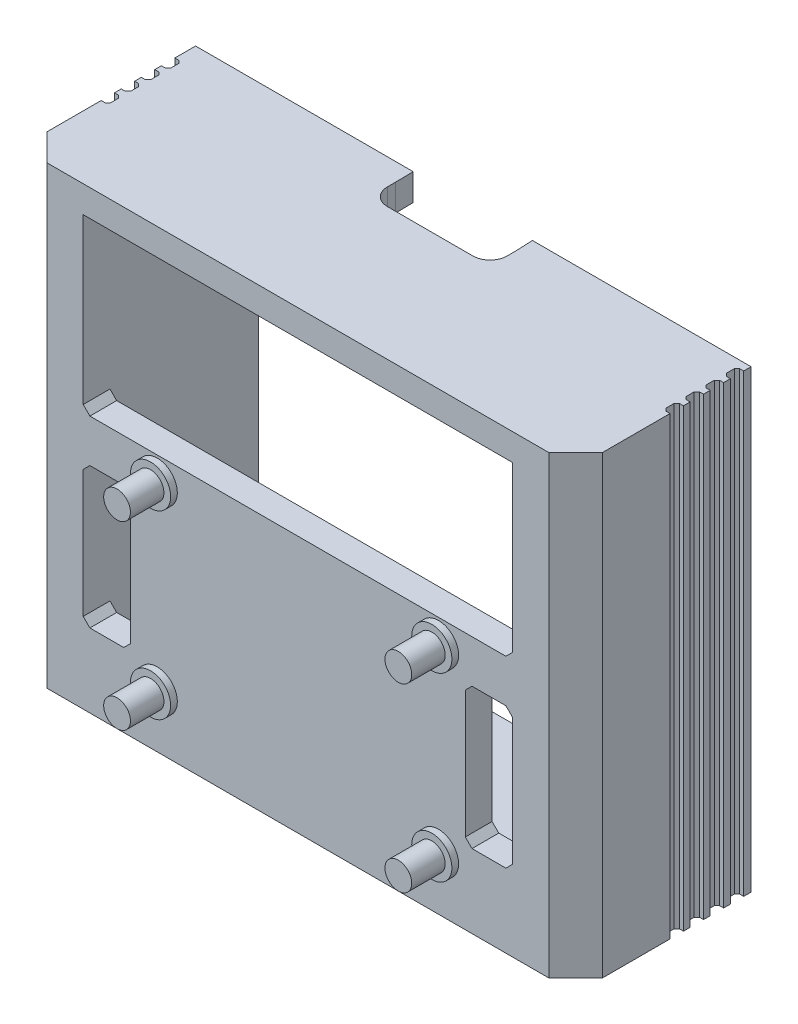
from build123d import *

# Parameters (mm, degrees)
SKETCH_1_W          = 4.708553468
SKETCH_1_H          = 29.97466091
EXTRUDE_1_DEPTH     = 4.1
EXTRUDE_1_2_DEPTH   = 4.1
SKETCH_2_W          = 4.708553468
SKETCH_2_H          = 29.97466091
EXTRUDE_2_DEPTH     = 9
SKETCH_3_W          = 6
SKETCH_3_H          = 29.97466091
EXTRUDE_3_DEPTH     = 32.057569214
SKETCH_6_R          = 1
EXTRUDE_4_DEPTH     = 3
SKETCH_7_R          = 1.5
EXTRUDE_5_DEPTH     = 0.5
CUT_EXTRUDE_1_REACH = 33.926
SKETCH_9_W          = 32.057569214
SKETCH_9_H          = 5.97466091
EXTRUDE_6_DEPTH     = 2
SKETCH_12_W         = 4.708553468
SKETCH_12_H         = 13.1
EXTRUDE_7_DEPTH     = 2
SKETCH_13_W         = 32.057569214
SKETCH_13_H         = 6
CUT_EXTRUDE_3_DEPTH = 6.8
CUT_EXTRUDE_4_REACH = 35.242
SKETCH_14_W         = 3.528784607
SKETCH_14_H         = 10.5
CHAMFER_1_SIZE      = 2
CHAMFER_2_SIZE      = 0.5
CUT_EXTRUDE_5_REACH = 44.936
SKETCH_15_W         = 0.5
SKETCH_15_H         = 1
CHAMFER_3_SIZE      = 0.2
CHAMFER_4_SIZE      = 0.2
SKETCH_16_W         = 32.057569214
SKETCH_16_H         = 2
EXTRUDE_8_DEPTH     = 13.1
CUT_EXTRUDE_7_REACH = 43.372
SKETCH_18_W         = 32.057569214
SKETCH_18_H         = 2
EXTRUDE_9_DEPTH     = 7.1
CUT_EXTRUDE_8_DEPTH = 4


with BuildPart() as part:
    # 草图1 → 凸台-拉伸1 (new body)
    with BuildSketch(Plane.XY):
        with Locations((-18.383061341, 5.449009398)):
            Rectangle(SKETCH_1_W, SKETCH_1_H)
    extrude(amount=EXTRUDE_1_DEPTH)



with BuildPart() as body_2:
    # 草图1 → Extrude 1 2 (new body)
    with BuildSketch(Plane.XY):
        with Locations((18.383061341, 5.449009398)):
            Rectangle(SKETCH_1_W, SKETCH_1_H)
    extrude(amount=EXTRUDE_1_2_DEPTH)


with BuildPart() as part_1:
    add(part.part)

    add(body_2.part)  # 凸台-拉伸2 merges body 2
    # 草图2 → 凸台-拉伸2 (add)
    with BuildSketch(Plane.XY.offset(4.1)):
        with Locations((-18.383061341, 5.449009398)):
            Rectangle(SKETCH_2_W, SKETCH_2_H)
        with Locations((18.383061341, 5.449009398)):
            Rectangle(SKETCH_2_W, SKETCH_2_H)
    extrude(amount=EXTRUDE_2_DEPTH)

    # 草图3 → 凸台-拉伸3 (add)
    with BuildSketch(Plane.ZY.offset(-16.028784607)):
        with Locations((10.1, 5.449009398)):
            Rectangle(SKETCH_3_W, SKETCH_3_H)
    extrude(amount=EXTRUDE_3_DEPTH)

    # 草图6 → 凸台-拉伸4 (add)
    with BuildSketch(Plane.XY.offset(13.1)):
        with Locations((-10.5, 5.961678943)):
            Circle(SKETCH_6_R)
        with Locations((10.5, -7.538321057)):
            Circle(SKETCH_6_R)
        with Locations((-10.5, -7.538321057)):
            Circle(SKETCH_6_R)
        with Locations((10.5, 5.961678943)):
            Circle(SKETCH_6_R)
    extrude(amount=EXTRUDE_4_DEPTH)

    # 草图7 → 凸台-拉伸5 (add)
    with BuildSketch(Plane.XY.offset(13.1)):
        with Locations((-10.5, 5.961678943)):
            Circle(SKETCH_7_R)
        with Locations((-10.5, -7.538321057)):
            Circle(SKETCH_7_R)
        with Locations(Location((10.5, -7.538321057, 0), (0, 0, 180))):
            Circle(SKETCH_7_R)
        with Locations(Location((10.5, 5.961678943, 0), (0, 0, 180))):
            Circle(SKETCH_7_R)
    extrude(amount=EXTRUDE_5_DEPTH)

    # 草图9 → 切除-拉伸1 (cut, up to next)
    with BuildSketch(Plane.XY.offset(13.1), mode=Mode.PRIVATE) as cut_extrude_1_sk1:
        with Locations((0, 17.449009398)):
            Rectangle(SKETCH_9_W, SKETCH_9_H)
    cut_extrude_1_tool1 = extrude(cut_extrude_1_sk1.sketch, amount=-CUT_EXTRUDE_1_REACH, mode=Mode.PRIVATE) & part_1.part
    add(cut_extrude_1_tool1.solids().sort_by_distance((0, 17.449009, 13.1))[0], mode=Mode.SUBTRACT)

    # 草图11 → 凸台-拉伸6 (add)
    with BuildSketch(Plane.XZ.offset(9.538321057)):
        Polygon((-20.737338075, 0), (-16.028784607, 0), (-16.028784607, 7.1), (16.028784607, 7.1), (16.028784607, 0), (20.737338075, 0), (20.737338075, 13.1), (-20.737338075, 13.1), align=None)
    extrude(amount=EXTRUDE_6_DEPTH)

    # 草图12 → 凸台-拉伸7 (add)
    with BuildSketch(Plane(origin=(0, 20.436339853, 0), x_dir=(1, 0, 0), z_dir=(0, 1, 0))):
        with Locations((18.383061341, -6.55)):
            Rectangle(SKETCH_12_W, SKETCH_12_H)
        with Locations((-18.383061341, -6.55)):
            Rectangle(SKETCH_12_W, SKETCH_12_H)
    extrude(amount=EXTRUDE_7_DEPTH)

    # 草图13 → 切除-拉伸3 (cut)
    with BuildSketch(Plane(origin=(0, 14.461678943, 0), x_dir=(1, 0, 0), z_dir=(0, 1, 0))):
        with Locations((0, -10.1)):
            Rectangle(SKETCH_13_W, SKETCH_13_H)
    extrude(amount=-CUT_EXTRUDE_3_DEPTH, mode=Mode.SUBTRACT)

    # 草图14 → 切除-拉伸4 (cut, up to next)
    with BuildSketch(Plane.XY.offset(13.1), mode=Mode.PRIVATE) as cut_extrude_4_sk1:
        with Locations((-14.264392304, -0.788321057)):
            Rectangle(SKETCH_14_W, SKETCH_14_H)
    cut_extrude_4_tool1 = extrude(cut_extrude_4_sk1.sketch, amount=-CUT_EXTRUDE_4_REACH, mode=Mode.PRIVATE) & part_1.part
    # 草图14 → 切除-拉伸4 (cut, up to next)
    with BuildSketch(Plane.XY.offset(13.1), mode=Mode.PRIVATE) as cut_extrude_4_sk2:
        with Locations((14.264392304, -0.788321057)):
            Rectangle(SKETCH_14_W, SKETCH_14_H)
    cut_extrude_4_tool2 = extrude(cut_extrude_4_sk2.sketch, amount=-CUT_EXTRUDE_4_REACH, mode=Mode.PRIVATE) & part_1.part
    add(cut_extrude_4_tool1.solids().sort_by_distance((-14.264392, -0.788321, 13.1))[0], mode=Mode.SUBTRACT)
    add(cut_extrude_4_tool2.solids().sort_by_distance((14.264392, -0.788321, 13.1))[0], mode=Mode.SUBTRACT)

    # 倒角1
    chamfer_1_edges = [part_1.edges().sort_by_distance(p)[0] for p in [
        (-20.737338075, 5.449009398, 13.1),
        (20.737338075, 5.449009398, 13.1),
    ]]
    chamfer(chamfer_1_edges, length=CHAMFER_1_SIZE)

    # 倒角2
    chamfer_2_edges = [part_1.edges().sort_by_distance(p)[0] for p in [
        (16.028784607, 7.661678943, 10.1),
        (-16.028784607, 7.661678943, 10.1),
        (-16.028784607, -6.038321057, 10.1),
        (-12.5, 4.461678943, 10.1),
        (-12.5, -6.038321057, 10.1),
        (-16.028784607, 4.461678943, 10.1),
        (16.028784607, 4.461678943, 10.1),
        (12.5, 4.461678943, 10.1),
        (16.028784607, -6.038321057, 10.1),
        (12.5, -6.038321057, 10.1),
    ]]
    chamfer(chamfer_2_edges, length=CHAMFER_2_SIZE)

    # 草图15 → 切除-拉伸5 (cut, up to next)
    with BuildSketch(Plane.XZ.offset(11.538321057), mode=Mode.PRIVATE) as cut_extrude_5_sk1:
        with Locations((-20.487338075, 5.05)):
            Rectangle(SKETCH_15_W, SKETCH_15_H)
    cut_extrude_5_tool1 = extrude(cut_extrude_5_sk1.sketch, amount=-CUT_EXTRUDE_5_REACH, mode=Mode.PRIVATE) & part_1.part
    # 草图15 → 切除-拉伸5 (cut, up to next)
    with BuildSketch(Plane.XZ.offset(11.538321057), mode=Mode.PRIVATE) as cut_extrude_5_sk2:
        with Locations((-20.487338075, 3.55)):
            Rectangle(SKETCH_15_W, SKETCH_15_H)
    cut_extrude_5_tool2 = extrude(cut_extrude_5_sk2.sketch, amount=-CUT_EXTRUDE_5_REACH, mode=Mode.PRIVATE) & part_1.part
    # 草图15 → 切除-拉伸5 (cut, up to next)
    with BuildSketch(Plane.XZ.offset(11.538321057), mode=Mode.PRIVATE) as cut_extrude_5_sk3:
        with Locations((-20.487338075, 2.05)):
            Rectangle(SKETCH_15_W, SKETCH_15_H)
    cut_extrude_5_tool3 = extrude(cut_extrude_5_sk3.sketch, amount=-CUT_EXTRUDE_5_REACH, mode=Mode.PRIVATE) & part_1.part
    # 草图15 → 切除-拉伸5 (cut, up to next)
    with BuildSketch(Plane.XZ.offset(11.538321057), mode=Mode.PRIVATE) as cut_extrude_5_sk4:
        with Locations((-20.487338075, 6.55)):
            Rectangle(SKETCH_15_W, SKETCH_15_H)
    cut_extrude_5_tool4 = extrude(cut_extrude_5_sk4.sketch, amount=-CUT_EXTRUDE_5_REACH, mode=Mode.PRIVATE) & part_1.part
    # 草图15 → 切除-拉伸5 (cut, up to next)
    with BuildSketch(Plane.XZ.offset(11.538321057), mode=Mode.PRIVATE) as cut_extrude_5_sk5:
        with Locations((20.487338075, 5.55)):
            Rectangle(SKETCH_15_W, SKETCH_15_H)
    cut_extrude_5_tool5 = extrude(cut_extrude_5_sk5.sketch, amount=-CUT_EXTRUDE_5_REACH, mode=Mode.PRIVATE) & part_1.part
    # 草图15 → 切除-拉伸5 (cut, up to next)
    with BuildSketch(Plane.XZ.offset(11.538321057), mode=Mode.PRIVATE) as cut_extrude_5_sk6:
        with Locations((20.487338075, 1.05)):
            Rectangle(SKETCH_15_W, SKETCH_15_H)
    cut_extrude_5_tool6 = extrude(cut_extrude_5_sk6.sketch, amount=-CUT_EXTRUDE_5_REACH, mode=Mode.PRIVATE) & part_1.part
    # 草图15 → 切除-拉伸5 (cut, up to next)
    with BuildSketch(Plane.XZ.offset(11.538321057), mode=Mode.PRIVATE) as cut_extrude_5_sk7:
        with Locations((20.487338075, 2.55)):
            Rectangle(SKETCH_15_W, SKETCH_15_H)
    cut_extrude_5_tool7 = extrude(cut_extrude_5_sk7.sketch, amount=-CUT_EXTRUDE_5_REACH, mode=Mode.PRIVATE) & part_1.part
    # 草图15 → 切除-拉伸5 (cut, up to next)
    with BuildSketch(Plane.XZ.offset(11.538321057), mode=Mode.PRIVATE) as cut_extrude_5_sk8:
        with Locations((20.487338075, 4.05)):
            Rectangle(SKETCH_15_W, SKETCH_15_H)
    cut_extrude_5_tool8 = extrude(cut_extrude_5_sk8.sketch, amount=-CUT_EXTRUDE_5_REACH, mode=Mode.PRIVATE) & part_1.part
    add(cut_extrude_5_tool1.solids().sort_by_distance((-20.487338, -11.538321, 5.05))[0], mode=Mode.SUBTRACT)
    add(cut_extrude_5_tool2.solids().sort_by_distance((-20.487338, -11.538321, 3.55))[0], mode=Mode.SUBTRACT)
    add(cut_extrude_5_tool3.solids().sort_by_distance((-20.487338, -11.538321, 2.05))[0], mode=Mode.SUBTRACT)
    add(cut_extrude_5_tool4.solids().sort_by_distance((-20.487338, -11.538321, 6.55))[0], mode=Mode.SUBTRACT)
    add(cut_extrude_5_tool5.solids().sort_by_distance((20.487338, -11.538321, 5.55))[0], mode=Mode.SUBTRACT)
    add(cut_extrude_5_tool6.solids().sort_by_distance((20.487338, -11.538321, 1.05))[0], mode=Mode.SUBTRACT)
    add(cut_extrude_5_tool7.solids().sort_by_distance((20.487338, -11.538321, 2.55))[0], mode=Mode.SUBTRACT)
    add(cut_extrude_5_tool8.solids().sort_by_distance((20.487338, -11.538321, 4.05))[0], mode=Mode.SUBTRACT)

    # 倒角3
    chamfer_3_edges = [part_1.edges().sort_by_distance(p)[0] for p in [
        (-20.237338075, 5.449009398, 4.05),
        (-20.237338075, 5.449009398, 3.05),
        (-20.237338075, 5.449009398, 2.55),
        (-20.237338075, 5.449009398, 1.55),
        (-20.237338075, 5.449009398, 7.05),
        (-20.237338075, 5.449009398, 6.05),
        (-20.237338075, 5.449009398, 5.55),
        (-20.237338075, 5.449009398, 4.55),
    ]]
    chamfer(chamfer_3_edges, length=CHAMFER_3_SIZE)

    # 倒角4
    chamfer_4_edges = [part_1.edges().sort_by_distance(p)[0] for p in [
        (20.237338075, 5.449009398, 6.05),
        (20.237338075, 5.449009398, 5.05),
        (20.237338075, 5.449009398, 1.55),
        (20.237338075, 5.449009398, 0.55),
        (20.237338075, 5.449009398, 3.05),
        (20.237338075, 5.449009398, 2.05),
        (20.237338075, 5.449009398, 4.55),
        (20.237338075, 5.449009398, 3.55),
    ]]
    chamfer(chamfer_4_edges, length=CHAMFER_4_SIZE)

    # 草图16 → 凸台-拉伸8 (add)
    with BuildSketch(Plane(origin=(0, 0, 0), x_dir=(-1, 0, 0), z_dir=(0, 0, -1))):
        with Locations((0, 21.436339853)):
            Rectangle(SKETCH_16_W, SKETCH_16_H)
    extrude(amount=-EXTRUDE_8_DEPTH)

    # 草图17 → 切除-拉伸7 (cut, up to next)
    with BuildSketch(Plane.XZ.offset(-20.436339853), mode=Mode.PRIVATE) as cut_extrude_7_sk1:
        with BuildLine():
            Line((4.465561881, 1.229756424), (4.470622966, 1.343469934))
            Line((4.470622966, 1.343469934), (4.470622966, 1.943469934))
            add(Edge.make_bspline(
                [(4.470622966, 1.943469934), (4.470622966, 3.223469934), (3.190622966, 3.223469934)],
                knots=[1.814608209, 1.814608209, 1.814608209, 3.385404536, 3.385404536, 3.385404536], degree=2, weights=[1, 0.707106781, 1]))
            Line((3.190622966, 3.223469934), (-3.189377034, 3.223469934))
            ThreePointArc((-3.189377034, 3.223469934), (-4.094473714, 2.848566614), (-4.469377034, 1.943469934))
            Line((-4.469377034, 1.943469934), (-4.469377034, 1.343469934))
            Line((-4.469377034, 1.343469934), (-4.489171494, 5.5e-08))
            Line((-4.489171494, 5.5e-08), (4.410828707, 4e-09))
            Line((4.410828707, 4e-09), (4.465561881, 1.229756424))
        make_face()
    cut_extrude_7_tool1 = extrude(cut_extrude_7_sk1.sketch, amount=-CUT_EXTRUDE_7_REACH, mode=Mode.PRIVATE) & part_1.part
    add(cut_extrude_7_tool1.solids().sort_by_distance((-0.00786, 20.43634, 1.579655))[0], mode=Mode.SUBTRACT)

    # 草图18 → 凸台-拉伸9 (add)
    with BuildSketch(Plane(origin=(0, 0, 7.1), x_dir=(-1, 0, 0), z_dir=(0, 0, -1))):
        with Locations((0, -10.538321057)):
            Rectangle(SKETCH_18_W, SKETCH_18_H)
    extrude(amount=EXTRUDE_9_DEPTH)

    # 草图19 → 切除-拉伸8 (cut)
    with BuildSketch(Plane(origin=(0, 0, 7.1), x_dir=(-1, 0, 0), z_dir=(0, 0, -1))):
        Polygon((-16.028784607, -5.538321057), (-16.028784607, -9.538321057), (16.028784607, -9.538321057), (16.028784607, -5.538321057), (15.528784607, -6.038321057), (13, -6.038321057), (12.5, -5.538321057), (12.5, 3.961678943), (13, 4.461678943), (15.528784607, 4.461678943), (16.028784607, 3.961678943), (16.028784607, 8.161678943), (15.528784607, 7.661678943), (-15.528784607, 7.661678943), (-16.028784607, 8.161678943), (-16.028784607, 3.961678943), (-15.528784607, 4.461678943), (-13, 4.461678943), (-12.5, 3.961678943), (-12.5, -5.538321057), (-13, -6.038321057), (-15.528784607, -6.038321057), align=None)
    extrude(amount=-CUT_EXTRUDE_8_DEPTH, mode=Mode.SUBTRACT)


solid = part_1.part
